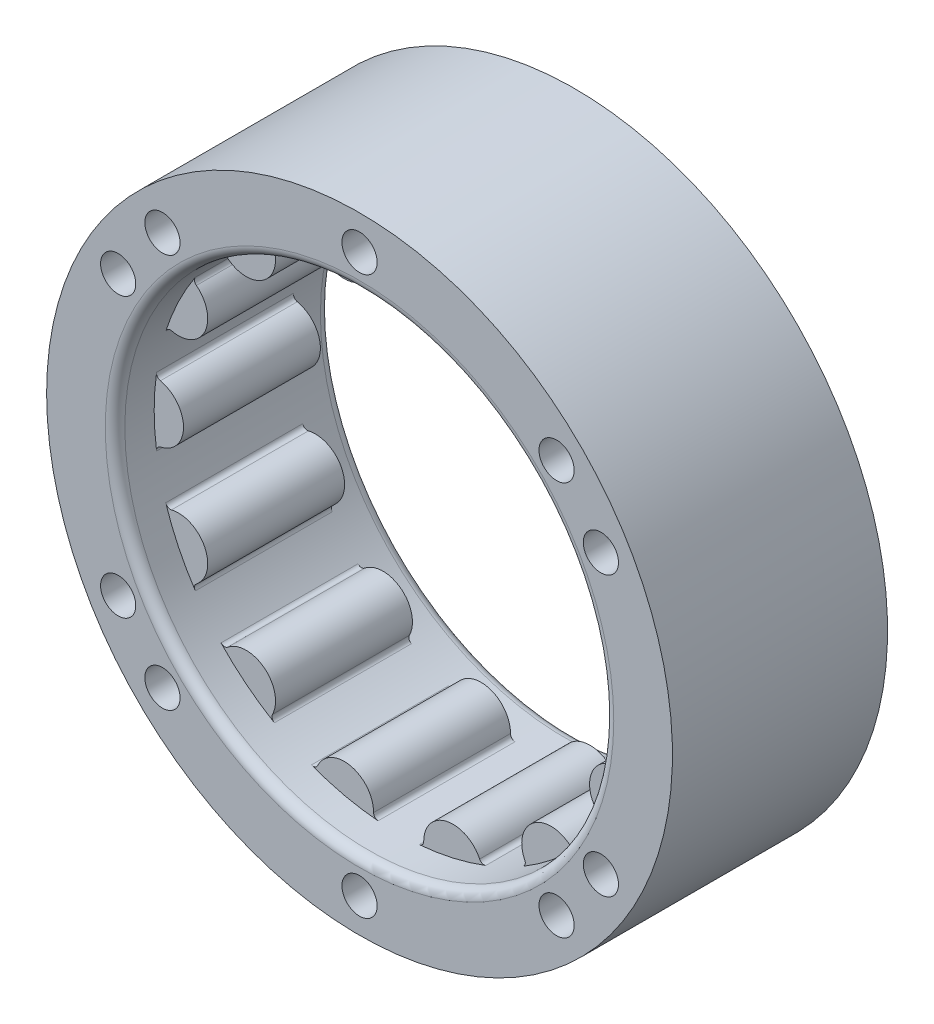
from build123d import *
from build123d.topology import SkipClean

# Parameters (mm, degrees)
PINSBASEEXTRUDE_DEPTH      = 0.4
PINSBASEEXTRUDE_DEPTH_BACK = 5
PINSBASESKETCH_R           = 28
PINSEXTRUDE_START          = -0.4
PINSSKETCH_R               = 3
PINSEXTRUDE_DEPTH          = 8.8
PINSPATTERN_COUNT          = 14
BOREREVOLVESKETCH_W        = 8
BOREREVOLVESKETCH_H        = 5
SKETCH_1_R                 = 5
CUT_EXTRUDE_1_DEPTH        = 42.494095966
SKETCH_2_R                 = 3
EXTRUDE_1_DEPTH            = 12
SKETCH_3_R                 = 28
SKETCH_3_R_2               = 5
CUT_EXTRUDE_2_DEPTH        = 0.4
SKETCH_5_R                 = 25
CUT_EXTRUDE_3_DEPTH        = 45.362146026
SKETCH_7_R                 = 29
SKETCH_7_R_2               = 28
EXTRUDE_2_DEPTH            = 5
SKETCH_17_R                = 29
EXTRUDE_9_DEPTH            = 20
SKETCH_18_R                = 29
CUT_EXTRUDE_5_DEPTH        = 5
FILLET_1_R                 = 0.5
SKETCH_20_R                = 29
CUT_EXTRUDE_7_DEPTH        = 6
SKETCH_21_R                = 29
SKETCH_21_R_2              = 25
EXTRUDE_10_DEPTH           = 4
EXTRUDE_START              = 4
SKETCH_22_R                = 29
SKETCH_22_R_2              = 25
EXTRUDE_11_DEPTH           = 4
SKETCH_23_R                = 32
SKETCH_23_R_2              = 29
EXTRUDE_12_DEPTH           = 22
SKETCH_24_R                = 1.8
CUT_EXTRUDE_8_DEPTH        = 51.318982502
SKETCH_25_R                = 1.8
CUT_EXTRUDE_9_DEPTH        = 5
FILLET_2_R                 = 1


with BuildPart() as part:
    # PinsBaseSketch → PinsBaseExtrude (new, two sides: drawn at the far end of the back side and taken through both)
    with BuildSketch(Plane.XY.offset(-PINSBASEEXTRUDE_DEPTH_BACK)):
        Circle(PINSBASESKETCH_R)
    extrude(amount=PINSBASEEXTRUDE_DEPTH + PINSBASEEXTRUDE_DEPTH_BACK)

    # PinsSketch → PinsExtrude (add)
    with BuildSketch(Plane.XY.offset(PINSEXTRUDE_START)):
        with Locations((25, 0)):
            Circle(PINSSKETCH_R)
    pinsextrude = extrude(amount=PINSEXTRUDE_DEPTH)

    # PinsPattern: PinsExtrude ×14 about axis
    pinspattern_axis = Axis((0, 0, 0), (0, 0, 1))
    for i in range(1, PINSPATTERN_COUNT):
        add(pinsextrude.rotate(pinspattern_axis, i * 360 / PINSPATTERN_COUNT))

    # BoreRevolveSketch → BoreRevolveCut (revolve, cut)
    with BuildSketch(Plane(origin=(0, 0, 0), x_dir=(0, 0, -1), z_dir=(1, 0, 0)), mode=Mode.PRIVATE) as borerevolvecut_sk:
        with Locations((0, 2.5)):
            Rectangle(BOREREVOLVESKETCH_W, BOREREVOLVESKETCH_H)
    revolve(borerevolvecut_sk.sketch.rotate(Axis((0, 0, 0), (0, 0, -1)), 90), axis=Axis((0, 0, 0), (0, 0, -1)), mode=Mode.SUBTRACT)

    # 草图1 → 切除-拉伸1 (cut, through all)
    with BuildSketch(Plane.XY.offset(-4)):
        Circle(SKETCH_1_R)
    extrude(amount=-CUT_EXTRUDE_1_DEPTH, mode=Mode.SUBTRACT)

    # 草图2 → 凸台-拉伸1 (add)
    with BuildSketch(Plane.XY.offset(8.4)):
        with Locations(Location((-15.587245046, -19.545787062, 0), (0, 0, 231.428076293))):
            Circle(SKETCH_2_R)
        with Locations(Location((-5.563023349, -24.373197805, 0), (0, 0, 257.14236202))):
            Circle(SKETCH_2_R)
        with Locations(Location((5.563023349, -24.373197805, 0), (0, 0, 282.856647734))):
            Circle(SKETCH_2_R)
        with Locations(Location((15.587245046, -19.545787062, 0), (0, 0, 308.570933628))):
            Circle(SKETCH_2_R)
        with Locations(Location((22.524221698, -10.847093478, 0), (0, 0, 334.285219093))):
            Circle(SKETCH_2_R)
        with Locations((25, 0)):
            Circle(SKETCH_2_R)
        with Locations(Location((22.524221698, 10.847093478, 0), (0, 0, 25.713790522))):
            Circle(SKETCH_2_R)
        with Locations(Location((15.587245046, 19.545787062, 0), (0, 0, 51.428076293))):
            Circle(SKETCH_2_R)
        with Locations(Location((5.563023349, 24.373197805, 0), (0, 0, 77.14236202))):
            Circle(SKETCH_2_R)
        with Locations(Location((-5.563023349, 24.373197805, 0), (0, 0, 102.856647733))):
            Circle(SKETCH_2_R)
        with Locations(Location((-15.587245046, 19.545787062, 0), (0, 0, 128.570933628))):
            Circle(SKETCH_2_R)
        with Locations(Location((-25, 0, 0), (0, 0, 179.999504907))):
            Circle(SKETCH_2_R)
        with Locations(Location((-22.524221698, 10.847093478, 0), (0, 0, 154.285219093))):
            Circle(SKETCH_2_R)
        with Locations(Location((-22.524221698, -10.847093478, 0), (0, 0, 205.713790522))):
            Circle(SKETCH_2_R)
    extrude(amount=EXTRUDE_1_DEPTH)

    # 草图3 → 切除-拉伸2 (cut)
    with BuildSketch(Plane(origin=(0, 0, -5), x_dir=(-1, 0, 0), z_dir=(0, 0, -1))):
        Circle(SKETCH_3_R)
        with Locations(Location((0, 0, 0), (0, 0, 180))):
            Circle(SKETCH_3_R_2, mode=Mode.SUBTRACT)
    extrude(amount=-CUT_EXTRUDE_2_DEPTH, mode=Mode.SUBTRACT)

    # 草图5 → 切除-拉伸3 (cut, through all)
    with BuildSketch(Plane.XY.offset(0.4)):
        Circle(SKETCH_5_R)
    extrude(amount=-CUT_EXTRUDE_3_DEPTH, mode=Mode.SUBTRACT)

    # 草图7 → 凸台-拉伸2 (add)
    with BuildSketch(Plane(origin=(0, 0, -4.6), x_dir=(-1, 0, 0), z_dir=(0, 0, -1))):
        Circle(SKETCH_7_R)
        Circle(SKETCH_7_R_2, mode=Mode.SUBTRACT)
    extrude(amount=-EXTRUDE_2_DEPTH)

    # 草图17 → 凸台-拉伸9 (add)
    with SkipClean():  # the faces are left unmerged after this step: merging them gives an invalid solid
        with BuildSketch(Plane.XY.offset(0.4)):
            with Locations(Location((0, 0, 0), (0, 0, 180))):
                Circle(SKETCH_17_R)
            with BuildLine():
                ThreePointArc((24.82, 2.994595131), (28, 0), (24.82, -2.994595131))
                ThreePointArc((24.82, -2.994595131), (24.373197805, -5.563023349), (23.661353434, -8.07095742))
                ThreePointArc((23.661353434, -8.07095742), (25.227128301, -12.148744695), (21.062741169, -13.46703139))
                ThreePointArc((21.062741169, -13.46703139), (19.545787062, -15.587245046), (17.816285633, -17.53795787))
                ThreePointArc((17.816285633, -17.53795787), (17.457714452, -21.891281509), (13.133748131, -21.27215692))
                ThreePointArc((13.133748131, -21.27215692), (10.847093478, -22.524221698), (8.44248396, -23.531350675))
                ThreePointArc((8.44248396, -23.531350675), (6.230586151, -27.297981541), (2.603455202, -24.864070886))
                ThreePointArc((2.603455202, -24.864070886), (0, -25), (-2.603455202, -24.864070886))
                ThreePointArc((-2.603455202, -24.864070886), (-6.230586151, -27.297981541), (-8.44248396, -23.531350675))
                ThreePointArc((-8.44248396, -23.531350675), (-10.847093478, -22.524221698), (-13.133748131, -21.27215692))
                ThreePointArc((-13.133748131, -21.27215692), (-17.457714452, -21.891281509), (-17.816285633, -17.53795787))
                ThreePointArc((-17.816285633, -17.53795787), (-19.545787062, -15.587245046), (-21.062741169, -13.46703139))
                ThreePointArc((-21.062741169, -13.46703139), (-25.227128301, -12.148744695), (-23.661353434, -8.07095742))
                ThreePointArc((-23.661353434, -8.07095742), (-24.373197805, -5.563023349), (-24.82, -2.994595131))
                ThreePointArc((-24.82, -2.994595131), (-28, 0), (-24.82, 2.994595131))
                ThreePointArc((-24.82, 2.994595131), (-24.373197805, 5.563023349), (-23.661353434, 8.07095742))
                ThreePointArc((-23.661353434, 8.07095742), (-25.227128301, 12.148744695), (-21.062741169, 13.46703139))
                ThreePointArc((-21.062741169, 13.46703139), (-19.545787062, 15.587245046), (-17.816285633, 17.53795787))
                ThreePointArc((-17.816285633, 17.53795787), (-17.457714452, 21.891281509), (-13.133748131, 21.27215692))
                ThreePointArc((-13.133748131, 21.27215692), (-10.847093478, 22.524221698), (-8.44248396, 23.531350675))
                ThreePointArc((-8.44248396, 23.531350675), (-6.230586151, 27.297981541), (-2.603455202, 24.864070886))
                ThreePointArc((-2.603455202, 24.864070886), (0, 25), (2.603455202, 24.864070886))
                ThreePointArc((2.603455202, 24.864070886), (6.230586151, 27.297981541), (8.44248396, 23.531350675))
                ThreePointArc((8.44248396, 23.531350675), (10.847093478, 22.524221698), (13.133748131, 21.27215692))
                ThreePointArc((13.133748131, 21.27215692), (17.457714452, 21.891281509), (17.816285633, 17.53795787))
                ThreePointArc((17.816285633, 17.53795787), (19.545787062, 15.587245046), (21.062741169, 13.46703139))
                ThreePointArc((21.062741169, 13.46703139), (25.227128301, 12.148744695), (23.661353434, 8.07095742))
                ThreePointArc((23.661353434, 8.07095742), (24.373197805, 5.563023349), (24.82, 2.994595131))
            make_face(mode=Mode.SUBTRACT)
        extrude(amount=EXTRUDE_9_DEPTH)

    # 草图18 → 切除-拉伸5 (cut)
    with BuildSketch(Plane(origin=(0, 0, -4.6), x_dir=(-1, 0, 0), z_dir=(0, 0, -1))):
        Circle(SKETCH_18_R)
    extrude(amount=-CUT_EXTRUDE_5_DEPTH, mode=Mode.SUBTRACT)

    # 圆角1
    fillet_1_edges = [part.edges().sort_by_distance(p)[0] for p in [
        (24.82, 2.994595131, 10.4),
        (24.82, -2.994595131, 10.4),
        (23.661353434, -8.07095742, 10.4),
        (21.062741169, -13.46703139, 10.4),
        (17.816285633, -17.53795787, 10.4),
        (13.133748131, -21.27215692, 10.4),
        (8.44248396, -23.531350675, 10.4),
        (2.603455202, -24.864070886, 10.4),
        (-2.603455202, -24.864070886, 10.4),
        (-8.44248396, -23.531350675, 10.4),
        (-13.133748131, -21.27215692, 10.4),
        (-17.816285633, -17.53795787, 10.4),
        (-21.062741169, -13.46703139, 10.4),
        (-23.661353434, -8.07095742, 10.4),
        (-24.82, -2.994595131, 10.4),
        (-24.82, 2.994595131, 10.4),
        (-23.661353434, 8.07095742, 10.4),
        (-21.062741169, 13.46703139, 10.4),
        (-17.816285633, 17.53795787, 10.4),
        (-13.133748131, 21.27215692, 10.4),
        (-8.44248396, 23.531350675, 10.4),
        (-2.603455202, 24.864070886, 10.4),
        (2.603455202, 24.864070886, 10.4),
        (8.44248396, 23.531350675, 10.4),
        (13.133748131, 21.27215692, 10.4),
        (17.816285633, 17.53795787, 10.4),
        (21.062741169, 13.46703139, 10.4),
        (23.661353434, 8.07095742, 10.4),
    ]]
    fillet(fillet_1_edges, radius=FILLET_1_R)

    # 草图20 → 切除-拉伸7 (cut)
    with BuildSketch(Plane(origin=(0, 0, 0.4), x_dir=(-1, 0, 0), z_dir=(0, 0, -1))):
        Circle(SKETCH_20_R)
    extrude(amount=-CUT_EXTRUDE_7_DEPTH, mode=Mode.SUBTRACT)

    # 草图21 → 凸台-拉伸10 (add)
    with BuildSketch(Plane.XY.offset(20.4)):
        with Locations(Location((0, 0, 0), (0, 0, 180))):
            Circle(SKETCH_21_R)
        Circle(SKETCH_21_R_2, mode=Mode.SUBTRACT)
    extrude(amount=EXTRUDE_10_DEPTH)

    # 草图22 → 凸台-拉伸11 (add)
    with BuildSketch(Plane(origin=(0, 0, 6.4), x_dir=(-1, 0, 0), z_dir=(0, 0, -1)).offset(EXTRUDE_START)):
        Circle(SKETCH_22_R)
        with Locations(Location((0, 0, 0), (0, 0, 180))):
            Circle(SKETCH_22_R_2, mode=Mode.SUBTRACT)
    extrude(amount=-EXTRUDE_11_DEPTH)

    # 草图23 → 凸台-拉伸12 (add)
    with BuildSketch(Plane(origin=(0, 0, 2.4), x_dir=(-1, 0, 0), z_dir=(0, 0, -1))):
        Circle(SKETCH_23_R)
        Circle(SKETCH_23_R_2, mode=Mode.SUBTRACT)
    extrude(amount=-EXTRUDE_12_DEPTH)

    # 草图24 → 切除-拉伸8 (cut, through all)
    with BuildSketch(Plane(origin=(0, 0, 2.4), x_dir=(-1, 0, 0), z_dir=(0, 0, -1))):
        with Locations((0, 28.5)):
            Circle(SKETCH_24_R)
        with Locations((24.681724008, 14.25)):
            Circle(SKETCH_24_R)
        with Locations((24.681724008, -14.25)):
            Circle(SKETCH_24_R)
        with Locations((0, -28.5)):
            Circle(SKETCH_24_R)
        with Locations((-24.681724008, -14.25)):
            Circle(SKETCH_24_R)
        with Locations((-24.681724008, 14.25)):
            Circle(SKETCH_24_R)
    extrude(amount=-CUT_EXTRUDE_8_DEPTH, mode=Mode.SUBTRACT)

    # 草图25 → 切除-拉伸9 (cut)
    with BuildSketch(Plane.XY.offset(24.4)):
        with Locations((20.152543264, 20.152543264)):
            Circle(SKETCH_25_R)
        with Locations((20.152543264, -20.152543264)):
            Circle(SKETCH_25_R)
        with Locations((-20.152543264, -20.152543264)):
            Circle(SKETCH_25_R)
        with Locations((-20.152543264, 20.152543264)):
            Circle(SKETCH_25_R)
    extrude(amount=-CUT_EXTRUDE_9_DEPTH, mode=Mode.SUBTRACT)

    # 圆角2
    fillet_2_edges = [part.edges().sort_by_distance(p)[0] for p in [
        (-25, 0, 24.4),
        (-25, 0, 2.4),
    ]]
    fillet(fillet_2_edges, radius=FILLET_2_R)


solid = part.part
